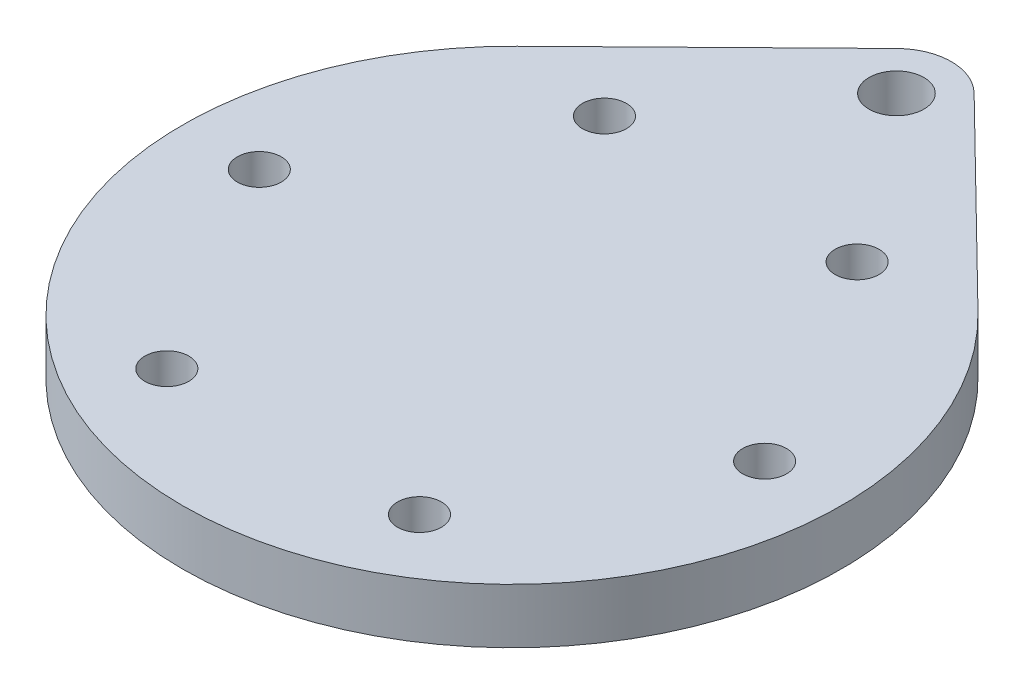
from build123d import *

# Parameters (mm, degrees)
SKETCH1_R           = 2
SKETCH1_R_2         = 5
SKETCH1_R_3         = 2.5
BOSS_EXTRUDE1_DEPTH = 5


with BuildPart() as part:
    # Sketch1 → Boss-Extrude1 (new body)
    # profile 1 of 4: a face of its own
    with BuildSketch(Plane(origin=(0, 0, 0), x_dir=(1, 0, 0), z_dir=(0, 1, 0))):
        with BuildLine():
            ThreePointArc((-1.9e-08, 30), (-11.338934199, 27.77460299), (-20.995626367, 21.428571429))
            ThreePointArc((-20.995626367, 21.428571429), (-11.621772864, -27.657447379), (30, 0))
            ThreePointArc((30, 0), (27.657447379, 11.621772864), (20.995626367, 21.428571429))
            ThreePointArc((20.995626367, 21.428571429), (11.338934182, 27.774602997), (-1.9e-08, 30))
        make_face()
        with Locations(Location((-11.5, -19.918584287, 0), (0, 0, 270))):
            Circle(SKETCH1_R, mode=Mode.SUBTRACT)
        with Locations(Location((-23, 0, 0), (0, 0, 270))):
            Circle(SKETCH1_R, mode=Mode.SUBTRACT)
        with Locations(Location((11.5, -19.918584287, 0), (0, 0, 270))):
            Circle(SKETCH1_R, mode=Mode.SUBTRACT)
        with Locations(Location((23, 0, 0), (0, 0, 270))):
            Circle(SKETCH1_R, mode=Mode.SUBTRACT)
        with Locations(Location((-11.5, 19.918584287, 0), (0, 0, 270))):
            Circle(SKETCH1_R, mode=Mode.SUBTRACT)
        with Locations(Location((11.5, 19.918584287, 0), (0, 0, 270))):
            Circle(SKETCH1_R, mode=Mode.SUBTRACT)
    # profile 2 of 4: a face of its own
    with BuildSketch(Plane(origin=(0, 0, 0), x_dir=(1, 0, 0), z_dir=(0, 1, 0))):
        with BuildLine():
            Line((20.995626367, 21.428571429), (3.499271061, 38.571428571))
            ThreePointArc((3.499271061, 38.571428571), (4.609574563, 36.936962144), (5, 35))
            ThreePointArc((5, 35), (3.535533899, 31.464466087), (-1.9e-08, 30))
            ThreePointArc((-1.9e-08, 30), (11.338934182, 27.774602997), (20.995626367, 21.428571429))
        make_face()
    # profile 3 of 4: a face of its own
    with BuildSketch(Plane(origin=(0, 0, 0), x_dir=(1, 0, 0), z_dir=(0, 1, 0))):
        with BuildLine():
            ThreePointArc((-1.9e-08, 30), (-4.629100502, 33.110177644), (-3.499271061, 38.571428571))
            Line((-3.499271061, 38.571428571), (-20.995626367, 21.428571429))
            ThreePointArc((-20.995626367, 21.428571429), (-11.338934199, 27.77460299), (-1.9e-08, 30))
        make_face()
    # profile 4 of 4: a face of its own
    with BuildSketch(Plane(origin=(0, 0, 0), x_dir=(1, 0, 0), z_dir=(0, 1, 0))):
        with Locations((0, 35)):
            Circle(SKETCH1_R_2)
        with Locations(Location((0, 35, 0), (0, 0, 270))):
            Circle(SKETCH1_R_3, mode=Mode.SUBTRACT)
    extrude(amount=BOSS_EXTRUDE1_DEPTH)


solid = part.part
